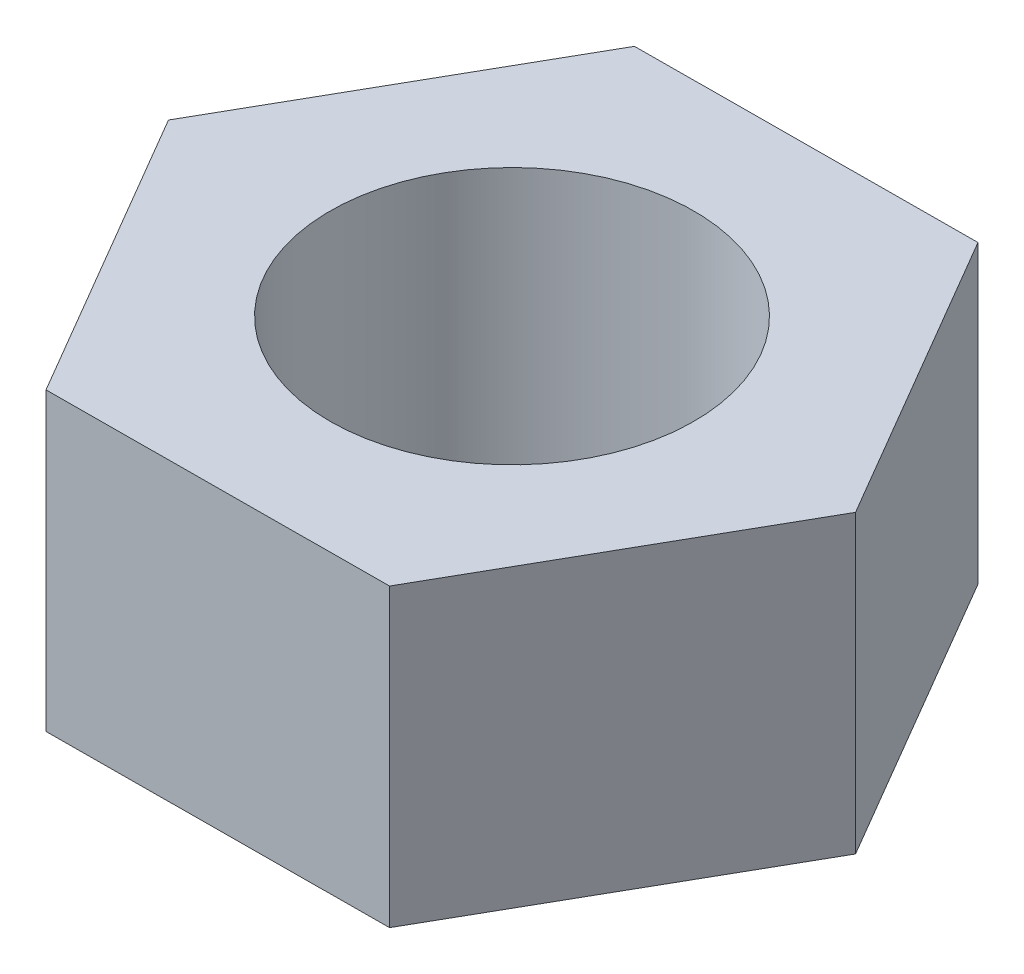
from build123d import *

# Parameters (mm, degrees)
BOSS_EXTRUDE1_DEPTH = 6.5
SKETCH2_R           = 4
CUT_EXTRUDE1_DEPTH  = 12.878646523


with BuildPart() as part:
    # Sketch1 → Boss-Extrude1 (new body)
    with BuildSketch(Plane(origin=(0, 0, 0), x_dir=(1, 0, 0), z_dir=(0, 1, 0))):
        Polygon((3.788896063, -6.479012267), (7.505437246, 0.041774109), (3.716541184, 6.520786376), (-3.788896063, 6.479012267), (-7.505437246, -0.041774109), (-3.716541184, -6.520786376), align=None)
    extrude(amount=BOSS_EXTRUDE1_DEPTH)

    # Sketch2 → Cut-Extrude1 (cut, through all)
    with BuildSketch(Plane(origin=(0, 6.5, 0), x_dir=(1, 0, 0), z_dir=(0, 1, 0))):
        with Locations(Location((0, 0, 0), (0, 0, 270))):
            Circle(SKETCH2_R)
    extrude(amount=-CUT_EXTRUDE1_DEPTH, mode=Mode.SUBTRACT)


solid = part.part
